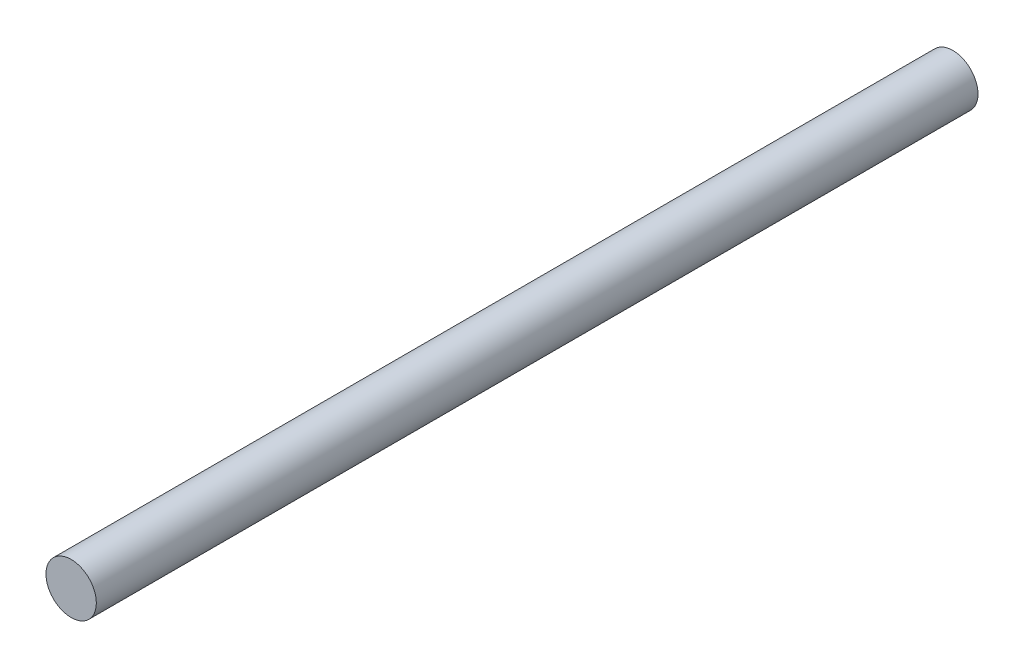
from build123d import *

# Parameters (mm, degrees)
ESBO_O1_R                = 5
RESSALTO_EXTRUS_O1_DEPTH = 87.5


with BuildPart() as part:
    # Esboço1 → Ressalto-extrusão1 (new, symmetric)
    with BuildSketch(Plane.XY):
        Circle(ESBO_O1_R)
    extrude(amount=RESSALTO_EXTRUS_O1_DEPTH, both=True)


solid = part.part
